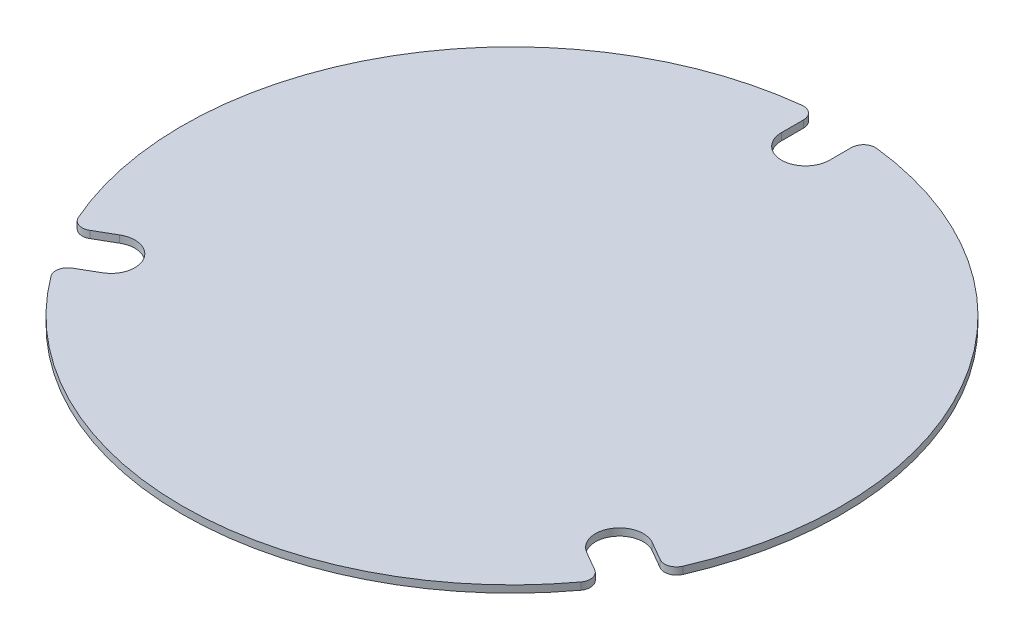
from build123d import *

# Parameters (mm, degrees)
BOSS_EXTRUDE1_DEPTH = 1.2
EXTRUDE_THIN1_DEPTH = 1.2


with BuildPart() as part:
    # Sketch2 → Boss-Extrude1 (new body)
    with BuildSketch(Plane(origin=(0, 0, 0), x_dir=(1, 0, 0), z_dir=(0, 1, 0))):
        with BuildLine():
            Line((-4, 52.659282183), (-4, 49))
            ThreePointArc((-4, 49), (0, 45), (4, 49))
            Line((4, 49), (4, 52.659282183))
            ThreePointArc((4, 52.659282183), (4.668239922, 54.151399837), (6.226415094, 54.646424907))
            ThreePointArc((6.226415094, 54.646424907), (47.631397208, 27.5), (50.438399742, -21.930978807))
            ThreePointArc((50.438399742, -21.930978807), (49.23060787, -23.032885555), (47.604276115, -22.865539476))
            Line((47.604276115, -22.865539476), (44.435244785, -21.035898385))
            ThreePointArc((44.435244785, -21.035898385), (38.97114317, -22.5), (40.435244785, -27.964101615))
            Line((40.435244785, -27.964101615), (43.604276115, -29.793742707))
            ThreePointArc((43.604276115, -29.793742707), (44.562367948, -31.118514282), (44.211984648, -32.7154461))
            ThreePointArc((44.211984648, -32.7154461), (0, -55), (-44.211984648, -32.715446099))
            ThreePointArc((-44.211984648, -32.715446099), (-44.562367948, -31.118514282), (-43.604276115, -29.793742706))
            Line((-43.604276115, -29.793742706), (-40.435244785, -27.964101615))
            ThreePointArc((-40.435244785, -27.964101615), (-38.97114317, -22.5), (-44.435244785, -21.035898385))
            Line((-44.435244785, -21.035898385), (-47.604276115, -22.865539476))
            ThreePointArc((-47.604276115, -22.865539476), (-49.23060787, -23.032885555), (-50.438399742, -21.930978807))
            ThreePointArc((-50.438399742, -21.930978807), (-47.631397208, 27.5), (-6.226415094, 54.646424907))
            ThreePointArc((-6.226415094, 54.646424907), (-4.668239922, 54.151399837), (-4, 52.659282183))
        make_face()
    extrude(amount=BOSS_EXTRUDE1_DEPTH)

    # Sketch3 → Extrude-Thin1 (add)
    with BuildSketch(Plane.XZ):
        with BuildLine():
            ThreePointArc((-6.016981132, -52.808317887), (-5.900117994, -52.771191007), (-5.85, -52.659282183))
            Line((-5.85, -52.659282183), (-5.85, -49))
            ThreePointArc((-5.85, -49), (0, -43.15), (5.85, -49))
            Line((5.85, -49), (5.85, -52.659282183))
            ThreePointArc((5.85, -52.659282183), (5.900117994, -52.771191007), (6.016981132, -52.808317887))
            ThreePointArc((6.016981132, -52.808317887), (46.029250211, -26.575), (48.741835387, 21.193300429))
            ThreePointArc((48.741835387, 21.193300429), (48.651250997, 21.275943435), (48.529276115, 21.263392479))
            Line((48.529276115, 21.263392479), (45.360244785, 19.433751388))
            ThreePointArc((45.360244785, 19.433751388), (37.368996173, 21.575), (39.510244785, 29.566248612))
            Line((39.510244785, 29.566248612), (42.679276115, 31.395889704))
            ThreePointArc((42.679276115, 31.395889704), (42.751133003, 31.495247572), (42.724854255, 31.615017458))
            ThreePointArc((42.724854255, 31.615017458), (0, 53.15), (-42.724854255, 31.615017458))
            ThreePointArc((-42.724854255, 31.615017458), (-42.751133003, 31.495247572), (-42.679276115, 31.395889703))
            Line((-42.679276115, 31.395889703), (-39.510244785, 29.566248612))
            ThreePointArc((-39.510244785, 29.566248612), (-37.368996173, 21.575), (-45.360244785, 19.433751388))
            Line((-45.360244785, 19.433751388), (-48.529276115, 21.263392479))
            ThreePointArc((-48.529276115, 21.263392479), (-48.651250997, 21.275943435), (-48.741835387, 21.193300429))
            ThreePointArc((-48.741835387, 21.193300429), (-46.029250211, -26.575), (-6.016981132, -52.808317887))
        make_face()
        with BuildLine():
            Line((-7.45, -51.008822766), (-7.45, -49))
            ThreePointArc((-7.45, -49), (0, -41.55), (7.45, -49))
            Line((7.45, -49), (7.45, -51.008822766))
            ThreePointArc((7.45, -51.008822766), (44.643609565, -25.775), (47.899936333, 19.052522125))
            Line((47.899936333, 19.052522125), (46.160244785, 18.048110742))
            ThreePointArc((46.160244785, 18.048110742), (35.983355527, 20.775), (38.710244785, 30.951889258))
            Line((38.710244785, 30.951889258), (40.449936333, 31.956300641))
            ThreePointArc((40.449936333, 31.956300641), (0, 51.55), (-40.449936333, 31.956300641))
            Line((-40.449936333, 31.956300641), (-38.710244785, 30.951889258))
            ThreePointArc((-38.710244785, 30.951889258), (-35.983355527, 20.775), (-46.160244785, 18.048110742))
            Line((-46.160244785, 18.048110742), (-47.899936333, 19.052522125))
            ThreePointArc((-47.899936333, 19.052522125), (-44.643609565, -25.775), (-7.45, -51.008822766))
        make_face(mode=Mode.SUBTRACT)
    extrude(amount=EXTRUDE_THIN1_DEPTH)


solid = part.part
